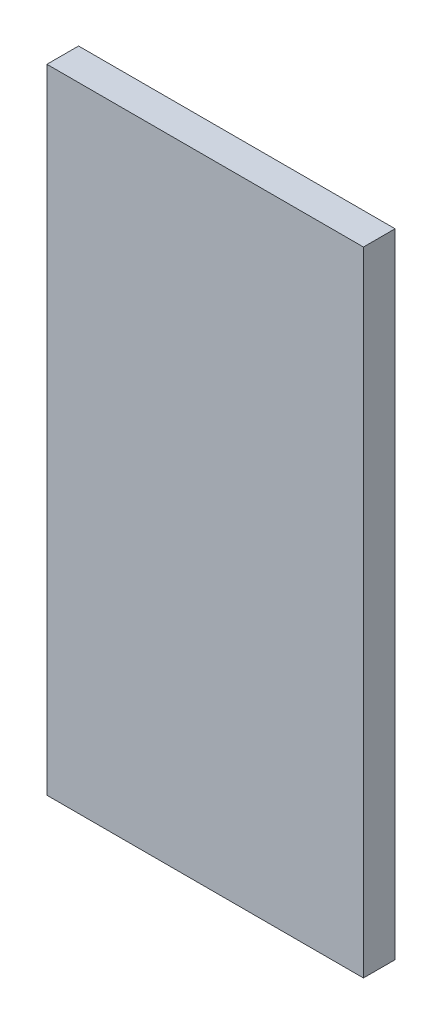
from build123d import *

# Parameters (mm, degrees)
SKETCH1_W           = 500
SKETCH1_H           = 1000
BOSS_EXTRUDE1_DEPTH = 50


with BuildPart() as part:
    # Sketch1 → Boss-Extrude1 (new body)
    with BuildSketch(Plane.XY):
        with Locations((196.032964072, 458.613599739)):
            Rectangle(SKETCH1_W, SKETCH1_H)
    extrude(amount=BOSS_EXTRUDE1_DEPTH)


solid = part.part
